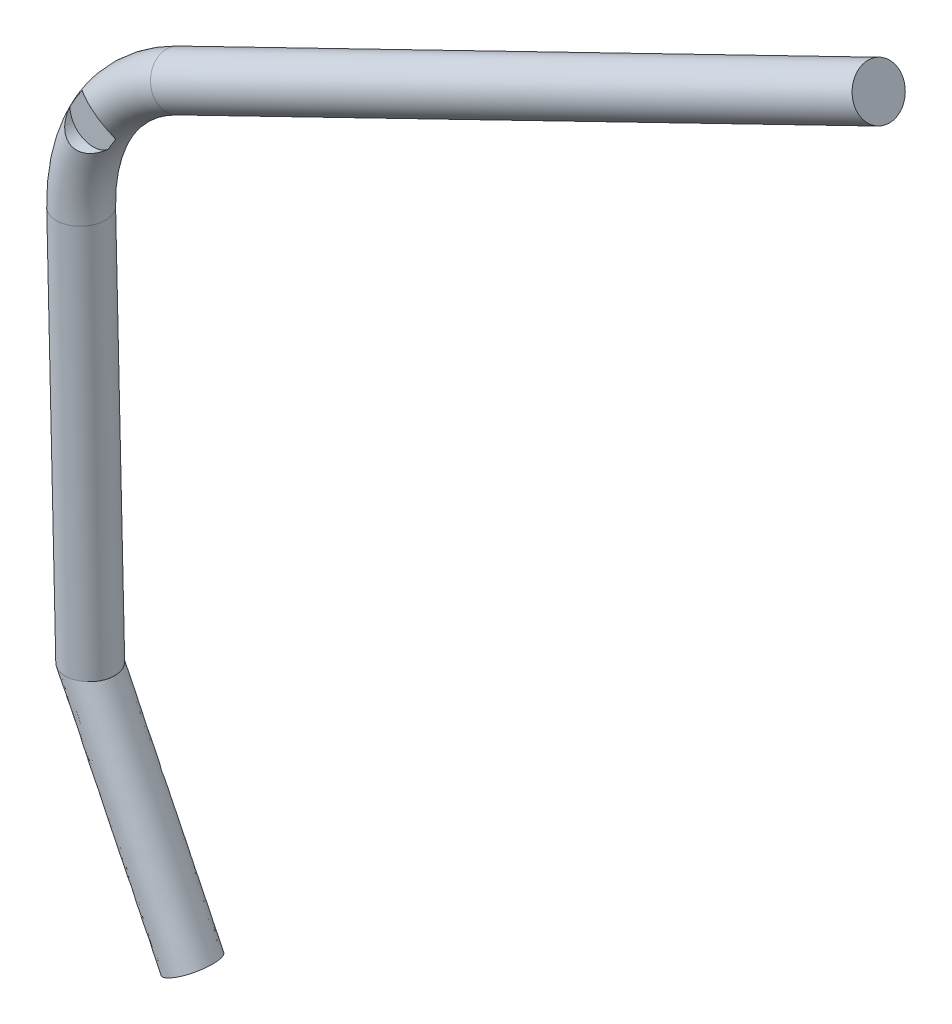
from build123d import *

# Parameters (mm, degrees)
SKETCH5_R               = 12.7
SKETCH6_R               = 12.7
BOSS_EXTRUDE3_DEPTH     = 406.4
SKETCH7_R               = 12.7
BOSS_EXTRUDE4_DEPTH     = 203.2
SKETCH8_R               = 12.065
CUT_EXTRUDE1_DEPTH      = 6.35
SKETCH9_R               = 12.7
CUT_EXTRUDE2_DEPTH      = 462.222817168
CUT_EXTRUDE2_DEPTH_BACK = 462.222817168


with BuildPart() as part:
    # Sweep1: sweep along a path in Sketch4
    with BuildLine(Plane.XY) as sweep1_path:
        ThreePointArc((-38.874671546, 79.949796199), (-75.907697444, 46.273442371), (-88.87582946, -2.072905643))
    # Sketch5 → Sweep1 (sweep)
    with BuildSketch(Plane(origin=(0, 0, 0), x_dir=(1, 0, 0), z_dir=(0, 1, 0))):
        with Locations((-88.87582946, 0)):
            Circle(SKETCH5_R)
    sweep(path=sweep1_path.line)

    # Sketch6 → Boss-Extrude3 (add)
    with BuildSketch(Plane(origin=(0, 0, 0), x_dir=(0, 0, -1), z_dir=(0.8993227918843839, 0.43728539421901275, 0))):
        with Locations(Location((0, 88.87582946, 0), (0, 0, 180))):
            Circle(SKETCH6_R)
    extrude(amount=BOSS_EXTRUDE3_DEPTH)

    # Sketch7 → Boss-Extrude4 (add)
    with BuildSketch(Plane(origin=(0, 0, 0), x_dir=(-0.9997281154099812, -0.023317273828803834, 0), z_dir=(0.023317273828803834, -0.9997281154099812, 0))):
        with Locations((88.87582946, 0)):
            Circle(SKETCH7_R)
    extrude(amount=BOSS_EXTRUDE4_DEPTH)

    # Sketch8 → Cut-Extrude1 (cut)
    with BuildSketch(Plane.XY.offset(12.7)):
        with Locations((-76.269889492, 46.494235168)):
            Circle(SKETCH8_R)
    extrude(amount=-CUT_EXTRUDE1_DEPTH, mode=Mode.SUBTRACT)

    # Sweep2: sweep along a path in Sketch11
    with BuildLine(Plane.XY) as sweep2_path:
        Line((-84.113595449, -205.217095104), (-28.578350384, -319.431089673))
    # Sketch9 → Sweep2 (sweep)
    with BuildSketch(Plane(origin=(4.738070042, -203.144753051, 0), x_dir=(-0.9997281154099812, -0.023317273828803834, 0), z_dir=(0.023317273828803834, -0.9997281154099812, 0))):
        with Locations((88.87582946, 0)):
            Circle(SKETCH9_R)
    sweep(path=sweep2_path.line)

    # Sketch16 → Cut-Extrude2 (cut, two sides: drawn at the far end of the back side and taken through both)
    with BuildSketch(Plane.XY.offset(-CUT_EXTRUDE2_DEPTH_BACK)):
        Polygon((-41.274897449, -319.727219051), (-20.504520989, -309.627861689), (-15.881803318, -319.134960295), align=None)
    extrude(amount=CUT_EXTRUDE2_DEPTH + CUT_EXTRUDE2_DEPTH_BACK, mode=Mode.SUBTRACT)


solid = part.part
